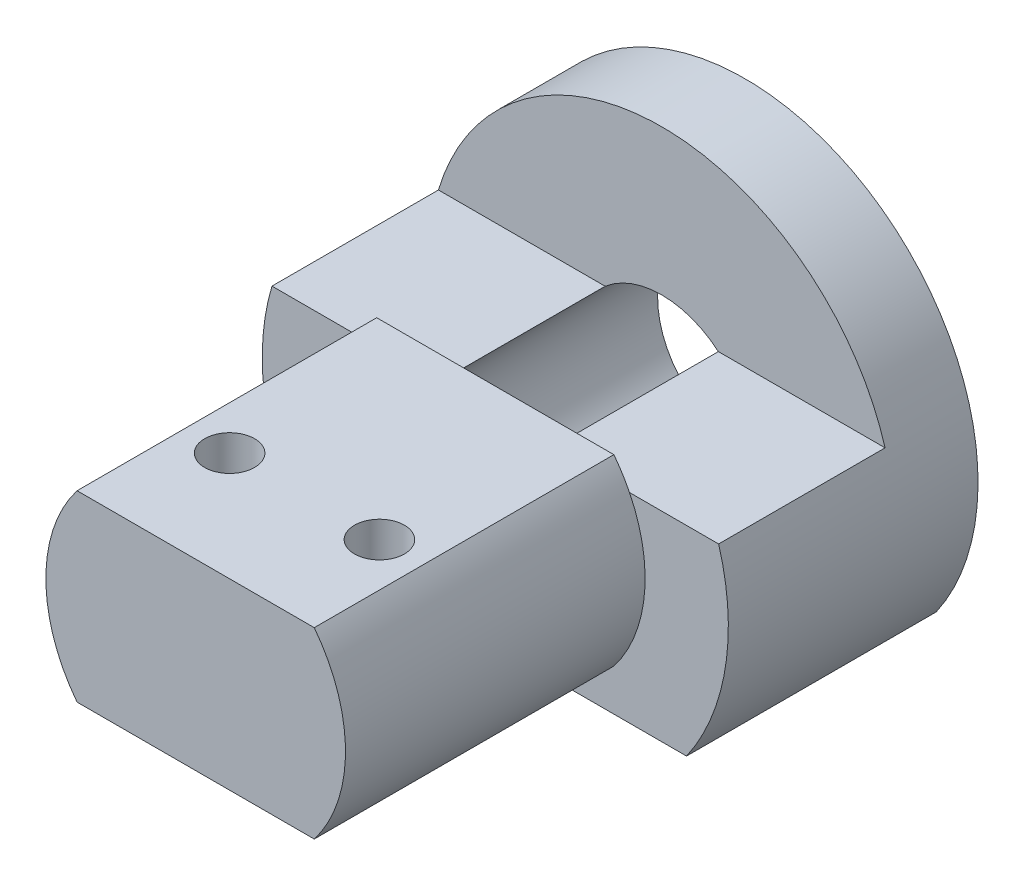
from build123d import *

# Parameters (mm, degrees)
SKETCH_1_R          = 5.25
EXTRUDE_1_DEPTH     = 15
CUT_EXTRUDE_START   = -10
CUT_EXTRUDE_1_DEPTH = 10
EXTRUDE_2_DEPTH     = 18
SKETCH_4_R          = 1.5
CUT_EXTRUDE_2_DEPTH = 39.304699451


with BuildPart() as part:
    # 草图1 → 凸台-拉伸1 (new body)
    with BuildSketch(Plane.XY):
        with BuildLine():
            Line((-11.489125293, -8), (11.489125293, -8))
            ThreePointArc((11.489125293, -8), (0, 14), (-11.489125293, -8))
        make_face()
        Circle(SKETCH_1_R, mode=Mode.SUBTRACT)
    extrude(amount=EXTRUDE_1_DEPTH)

    # 草图2 → 切除-拉伸1 (cut)
    with BuildSketch(Plane.XY.offset(15).offset(CUT_EXTRUDE_START)):
        with BuildLine():
            Line((-13.416407865, 4), (13.416407865, 4))
            ThreePointArc((13.416407865, 4), (0, 14), (-13.416407865, 4))
        make_face()
    extrude(amount=CUT_EXTRUDE_1_DEPTH, mode=Mode.SUBTRACT)

    # 草图3 → 凸台-拉伸2 (add)
    with BuildSketch(Plane.XY.offset(15)):
        with BuildLine():
            Line((-7.123903424, 5.5), (7.123903424, 5.5))
            ThreePointArc((7.123903424, 5.5), (9, 0), (7.123903424, -5.5))
            Line((7.123903424, -5.5), (-7.123903424, -5.5))
            ThreePointArc((-7.123903424, -5.5), (-9, 0), (-7.123903424, 5.5))
        make_face()
    extrude(amount=EXTRUDE_2_DEPTH)

    # 草图4 → 切除-拉伸2 (cut, through all)
    with BuildSketch(Plane(origin=(0, 5.5, 0), x_dir=(1, 0, 0), z_dir=(0, 1, 0))):
        with Locations(Location((4.5, -26.46, 0), (0, 0, 270))):
            Circle(SKETCH_4_R)
        with Locations(Location((-4.5, -26.46, 0), (0, 0, 180))):
            Circle(SKETCH_4_R)
    extrude(amount=-CUT_EXTRUDE_2_DEPTH, mode=Mode.SUBTRACT)


solid = part.part
